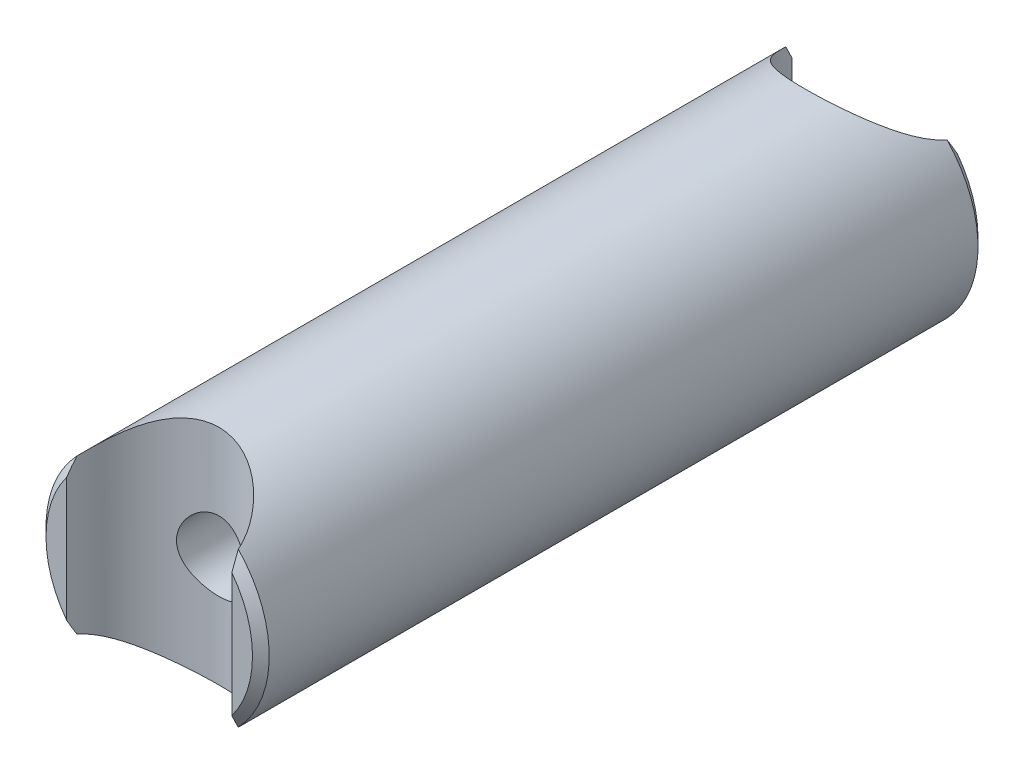
from build123d import *

# Parameters (mm, degrees)
ESQUISSE1_R                  = 4
ESQUISSE1_R_2                = 1.25
BOSS_EXTRU_1_DEPTH           = 13
CHANFREIN1_SIZE              = 0.3
ENL_V_MAT_EXTRU_1_DEPTH      = 15.177446879
ENL_V_MAT_EXTRU_1_DEPTH_BACK = 15.177446879
ESQUISSE2_R                  = 3


with BuildPart() as part:
    # Esquisse1 → Boss.-Extru.1 (new, symmetric)
    with BuildSketch(Plane.XY):
        with Locations(Location((0, 0, 0), (0, 0, 180))):
            Circle(ESQUISSE1_R)
        with Locations(Location((0, 0, 0), (0, 0, 180))):
            Circle(ESQUISSE1_R_2, mode=Mode.SUBTRACT)
    extrude(amount=BOSS_EXTRU_1_DEPTH, both=True)

    # Chanfrein1
    chanfrein1_edges = [part.edges().sort_by_distance(p)[0] for p in [
        (4, 0, -13),
        (4, 0, 13),
    ]]
    chamfer(chanfrein1_edges, length=CHANFREIN1_SIZE)

    # Esquisse2 → Enlèv. mat.-Extru.1 (cut, two sides: drawn at the far end of the back side and taken through both)
    with BuildSketch(Plane(origin=(0, 0, 0), x_dir=(1, 0, 0), z_dir=(0, 1, 0)).offset(-ENL_V_MAT_EXTRU_1_DEPTH_BACK)):
        with Locations((0, 13.5)):
            Circle(ESQUISSE2_R)
        with Locations((0, -13.5)):
            Circle(ESQUISSE2_R)
    extrude(amount=ENL_V_MAT_EXTRU_1_DEPTH + ENL_V_MAT_EXTRU_1_DEPTH_BACK, mode=Mode.SUBTRACT)


solid = part.part
